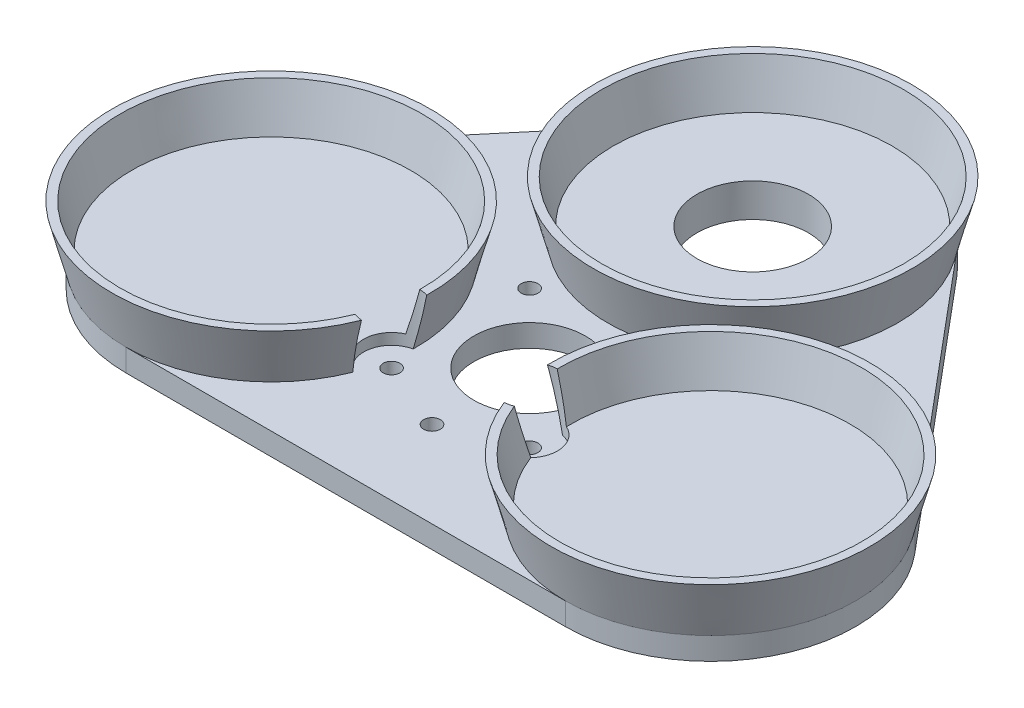
from build123d import *
from build123d.topology import SkipClean

# Parameters (mm, degrees)
SKETCH_1_R               = 26
EXTRUDE_1_DEPTH          = 2
EXTRUDE_1_2_DEPTH        = 2
EXTRUDE_1_3_DEPTH        = 2
EXTRUDE_START            = 4
SKETCH_2_R               = 10
EXTRUDE_2_DEPTH          = 4
SKETCH_3_R               = 1.5
CUT_EXTRUDE_1_DEPTH      = 4
PATTERN_CIRCULAR_2_COUNT = 2
PATTERN_CIRCULAR_2_ANGLE = 100
F_2_THE_OTHER_WAY_COUNT  = 2
F_2_THE_OTHER_WAY_ANGLE  = 100
SKETCH_5_R               = 5
CUT_EXTRUDE_2_DEPTH      = 10
SKETCH_7_R               = 10
CUT_EXTRUDE_3_DEPTH      = 10


with BuildPart() as part:
    # 草图1 → 凸台-拉伸1 (new body)
    with BuildSketch(Plane(origin=(0, 0, 0), x_dir=(1, 0, 0), z_dir=(0, 1, 0))):
        with Locations((0, 40)):
            Circle(SKETCH_1_R)
    extrude(amount=EXTRUDE_1_DEPTH)



with BuildPart() as body_2:
    # 草图1 → Extrude 1 2 (new body)
    with BuildSketch(Plane(origin=(0, 0, 0), x_dir=(1, 0, 0), z_dir=(0, 1, 0))):
        with Locations((39.39231012, -6.945927107)):
            Circle(SKETCH_1_R)
    extrude(amount=EXTRUDE_1_2_DEPTH)


with BuildPart() as body_3:
    # 草图1 → Extrude 1 3 (new body)
    with BuildSketch(Plane(origin=(0, 0, 0), x_dir=(1, 0, 0), z_dir=(0, 1, 0))):
        with Locations((-39.39231012, -6.945927107)):
            Circle(SKETCH_1_R)
    extrude(amount=EXTRUDE_1_3_DEPTH)


with BuildPart() as part_1:
    with SkipClean():  # the faces are left unmerged after this step: merging them gives an invalid solid
        add(part.part)

        add(body_2.part)  # 凸台-拉伸2 merges body 2

        add(body_3.part)  # 凸台-拉伸2 merges body 3
        # 草图2 → 凸台-拉伸2 (add)
        with BuildSketch(Plane.XZ.offset(EXTRUDE_START)):
            with BuildLine():
                Line((39.39231012, 32.945927107), (-39.39231012, 32.945927107))
                ThreePointArc((-39.39231012, 32.945927107), (-62.956312583, 17.934001912), (-59.309465642, -9.766550745))
                Line((-59.309465642, -9.766550745), (-19.917155521, -56.712477852))
                ThreePointArc((-19.917155521, -56.712477852), (0, -66), (19.917155521, -56.712477852))
                Line((19.917155521, -56.712477852), (59.309465642, -9.766550745))
                ThreePointArc((59.309465642, -9.766550745), (62.956312583, 17.934001912), (39.39231012, 32.945927107))
            make_face()
            Circle(SKETCH_2_R, mode=Mode.SUBTRACT)
        extrude(amount=-EXTRUDE_2_DEPTH)

    # 草图3 → 切除-拉伸1 (cut)
    with SkipClean():  # the faces are left unmerged after this step: merging them gives an invalid solid
        with BuildSketch(Plane(origin=(0, 0, 0), x_dir=(1, 0, 0), z_dir=(0, 1, 0))):
            with Locations((12.374368671, 12.374368671)):
                Circle(SKETCH_3_R)
            with Locations((-12.374368671, 12.374368671)):
                Circle(SKETCH_3_R)
            with Locations((-12.374368671, -12.374368671)):
                Circle(SKETCH_3_R)
            with Locations((12.374368671, -12.374368671)):
                Circle(SKETCH_3_R)
            with Locations((0, -17.5)):
                Circle(SKETCH_3_R)
        extrude(amount=-CUT_EXTRUDE_1_DEPTH, mode=Mode.SUBTRACT)

    # 草图4 → 旋转1 (revolve)
    with BuildSketch(Plane(origin=(0, 0, 0), x_dir=(0, 0, -1), z_dir=(1, 0, 0))):
        Polygon((68.570552361, 9.72740661), (67.070552361, 9.72740661), (65, 2), (66, 2), (66, 0), align=None)
    revolve_1 = revolve(axis=Axis((0, 2, -40), (0, 1, 0)))

    # 阵列(圆周)2: 旋转1 ×2 about axis
    with SkipClean():  # the faces are left unmerged after this step: merging them gives an invalid solid
        pattern_circular_2_axis = Axis((0, -6.257104181, 0), (0, 1, 0))
        for i in range(1, PATTERN_CIRCULAR_2_COUNT):
            add(revolve_1.rotate(pattern_circular_2_axis, i * PATTERN_CIRCULAR_2_ANGLE / (PATTERN_CIRCULAR_2_COUNT - 1)))

    # 2 the other way: 旋转1 ×2 about axis
    f_2_the_other_way_axis = Axis((0, -6.257104181, 0), (0, -1, 0))
    for i in range(1, F_2_THE_OTHER_WAY_COUNT):
        add(revolve_1.rotate(f_2_the_other_way_axis, i * F_2_THE_OTHER_WAY_ANGLE / (F_2_THE_OTHER_WAY_COUNT - 1)))

    # 草图5 → 切除-拉伸2 (cut)
    with BuildSketch(Plane(origin=(0, 0, 0), x_dir=(1, 0, 0), z_dir=(0, 1, 0))):
        with Locations((12.374368671, -12.374368671)):
            Circle(SKETCH_5_R)
        with Locations((-12.374368671, -12.374368671)):
            Circle(SKETCH_5_R)
    extrude(amount=CUT_EXTRUDE_2_DEPTH, mode=Mode.SUBTRACT)

    # 草图7 → 切除-拉伸3 (cut)
    with BuildSketch(Plane(origin=(0, 2, 0), x_dir=(1, 0, 0), z_dir=(0, 1, 0))):
        with Locations((0, 40)):
            Circle(SKETCH_7_R)
    extrude(amount=-CUT_EXTRUDE_3_DEPTH, mode=Mode.SUBTRACT)


solid = part_1.part
